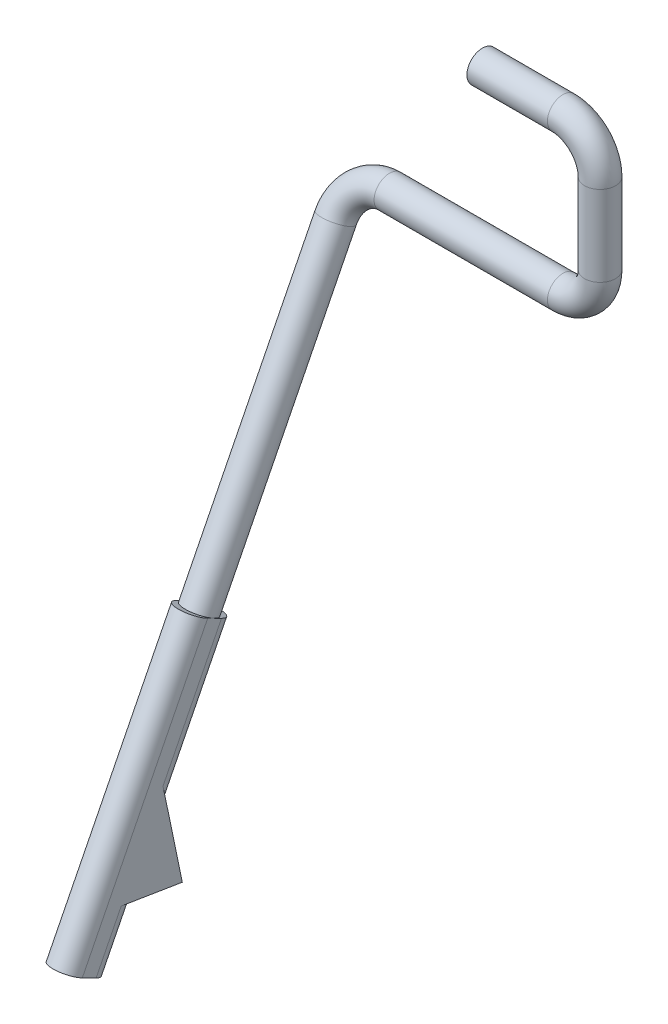
from build123d import *

# Parameters (mm, degrees)
SKETCH3_R           = 2.5
BOSS_EXTRUDE1_DEPTH = 45
BOSS_EXTRUDE2_DEPTH = 5


with BuildPart() as part:
    # Sweep1: sweep along a curve in space
    with BuildLine() as sweep1_path:
        Line((-34, -30.35817133, 2.7), (-34, -114.302855497, 45))
        ThreePointArc((-28, -25, 0), (-32.242640687, -26.569372048, 0.790811691), (-34, -30.35817133, 2.7))
        Line((0, -25, 0), (-28, -25, 0))
        ThreePointArc((0, -25, 0), (4.242640687, -23.242640687, 0), (6, -19, 0))
        Line((6, -6, 0), (6, -19, 0))
        ThreePointArc((0, 0, 0), (4.242640687, -1.757359313, 0), (6, -6, 0))
        Line((0, 0, 0), (-13, 0, 0))
    # Sketch3 → Sweep1 (sweep)
    with BuildSketch(Plane(origin=(-13, 0, 0), x_dir=(0, 0, -1), z_dir=(1, 0, 0))):
        Circle(SKETCH3_R)
    sweep(path=sweep1_path.line)

    # Sketch4 → Boss-Extrude1 (add)
    with BuildSketch(Plane(origin=(0, -109.240355497, 55.046571243), x_dir=(1, 0, 0), z_dir=(0, -0.8930285549745877, 0.45000000000000007))):
        with BuildLine():
            Line((-31.5, -11.25), (-31.5, -10))
            ThreePointArc((-31.5, -10), (-34, -7.5), (-36.5, -10))
            Line((-36.5, -10), (-36.5, -11.25))
            ThreePointArc((-36.5, -11.25), (-34, -8.75), (-31.5, -11.25))
        make_face()
        with BuildLine():
            Line((-31.5, -12.5), (-31.5, -11.25))
            ThreePointArc((-31.5, -11.25), (-34, -13.75), (-36.5, -11.25))
            Line((-36.5, -11.25), (-36.5, -12.5))
            ThreePointArc((-36.5, -12.5), (-34, -15), (-31.5, -12.5))
        make_face()
        with BuildLine():
            ThreePointArc((-36.5, -11.25), (-34, -13.75), (-31.5, -11.25))
            ThreePointArc((-31.5, -11.25), (-34, -8.75), (-36.5, -11.25))
        make_face()
    extrude(amount=-BOSS_EXTRUDE1_DEPTH)

    # Sketch5 → Boss-Extrude2 (add)
    with BuildSketch(Plane(origin=(-31.5, 0, 0), x_dir=(0, 0, -1), z_dir=(1, 0, 0))):
        Polygon((-39.833714306, -106.828098503), (-29.963286264, -108.432670178), (-33.083714306, -93.432670178), align=None)
    extrude(amount=-BOSS_EXTRUDE2_DEPTH)


solid = part.part
